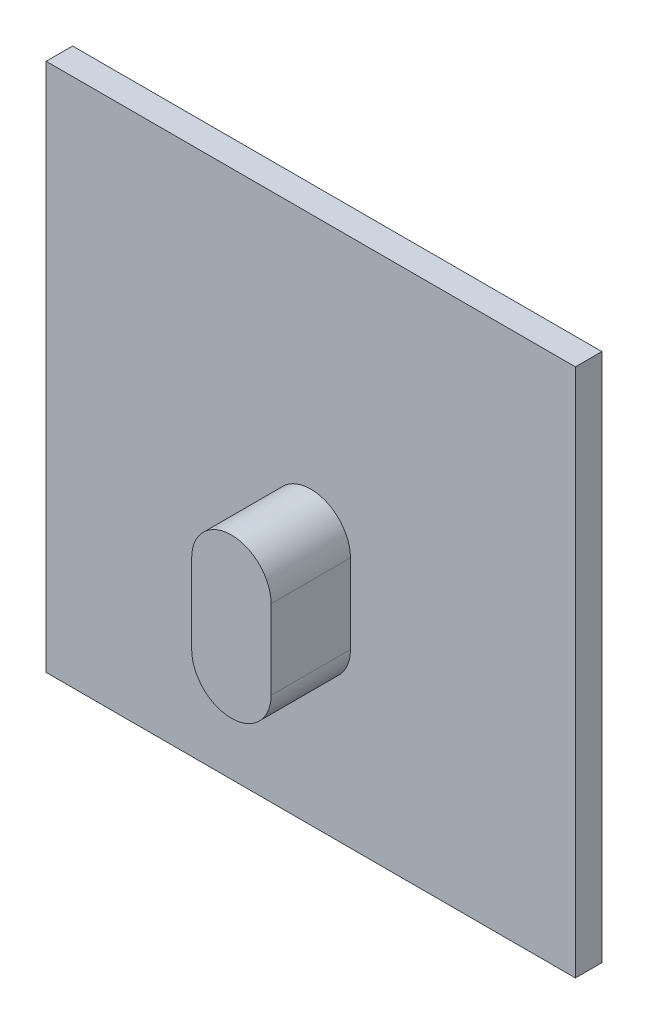
from build123d import *

# Parameters (mm, degrees)
SKETCH_1_W      = 40
SKETCH_1_H      = 40
EXTRUDE_1_DEPTH = 2
EXTRUDE_2_DEPTH = 8


with BuildPart() as part:
    # 스케치1 → 보스-돌출1 (new body)
    with BuildSketch(Plane.XY):
        Rectangle(SKETCH_1_W, SKETCH_1_H)
        with BuildLine():
            ThreePointArc((3, -7), (0, -10), (-3, -7))
            Line((-3, -7), (-3, -1))
            ThreePointArc((-3, -1), (0, 2), (3, -1))
            Line((3, -1), (3, -7))
        make_face(mode=Mode.SUBTRACT)
    extrude(amount=EXTRUDE_1_DEPTH)

    # 스케치1<3> → 보스-돌출2 (add)
    with BuildSketch(Plane.XY):
        with BuildLine():
            ThreePointArc((-3, -7), (0, -10), (3, -7))
            Line((3, -7), (3, -1))
            ThreePointArc((3, -1), (0, 2), (-3, -1))
            Line((-3, -1), (-3, -7))
        make_face()
    extrude(amount=EXTRUDE_2_DEPTH)


solid = part.part
